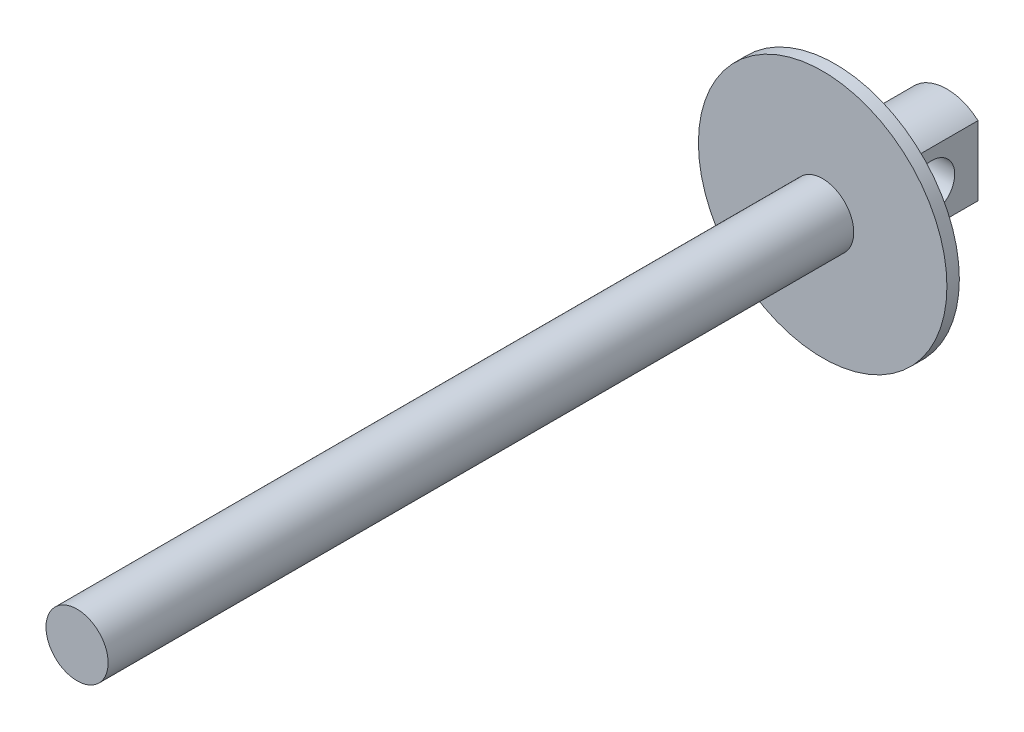
from build123d import *

# Parameters (mm, degrees)
SKETCH1_R               = 25.4
BOSS_EXTRUDE1_DEPTH     = 2.54
SKETCH2_R               = 6.35
BOSS_EXTRUDE2_DEPTH     = 152.4
SKETCH3_R               = 9.525
BOSS_EXTRUDE3_DEPTH     = 22.86
CUT_EXTRUDE2_DEPTH      = 160.049437597
CUT_EXTRUDE2_DEPTH_BACK = 160.049437597
SKETCH4_W               = 3.175
SKETCH4_H               = 19.05
CUT_EXTRUDE3_DEPTH      = 161.18622319
CUT_EXTRUDE3_DEPTH_BACK = 161.18622319
SKETCH5_R               = 4.7625


with BuildPart() as part:
    # Sketch1 → Boss-Extrude1 (new body)
    with BuildSketch(Plane.XY):
        Circle(SKETCH1_R)
    extrude(amount=BOSS_EXTRUDE1_DEPTH)

    # Sketch2 → Boss-Extrude2 (add)
    with BuildSketch(Plane.XY.offset(2.54)):
        with Locations(Location((0, 0, 0), (0, 0, 180))):
            Circle(SKETCH2_R)
    extrude(amount=BOSS_EXTRUDE2_DEPTH)

    # Sketch3 → Boss-Extrude3 (add)
    with BuildSketch(Plane(origin=(0, 0, 0), x_dir=(-1, 0, 0), z_dir=(0, 0, -1))):
        Circle(SKETCH3_R)
    extrude(amount=BOSS_EXTRUDE3_DEPTH)

    # Sketch4 → Cut-Extrude2 (cut, two sides: drawn at the far end of the back side and taken through both)
    with BuildSketch(Plane(origin=(0, 0, 0), x_dir=(1, 0, 0), z_dir=(0, 1, 0)).offset(-CUT_EXTRUDE2_DEPTH_BACK)):
        with Locations((7.9375, 13.335)):
            Rectangle(SKETCH4_W, SKETCH4_H)
        with Locations((-7.9375, 13.335)):
            Rectangle(SKETCH4_W, SKETCH4_H)
    extrude(amount=CUT_EXTRUDE2_DEPTH + CUT_EXTRUDE2_DEPTH_BACK, mode=Mode.SUBTRACT)

    # Sketch5 → Cut-Extrude3 (cut, two sides: drawn at the far end of the back side and taken through both)
    with BuildSketch(Plane.ZY.offset(6.35).offset(-CUT_EXTRUDE3_DEPTH_BACK)):
        with Locations((-13.335, 0)):
            Circle(SKETCH5_R)
    extrude(amount=CUT_EXTRUDE3_DEPTH + CUT_EXTRUDE3_DEPTH_BACK, mode=Mode.SUBTRACT)


solid = part.part
